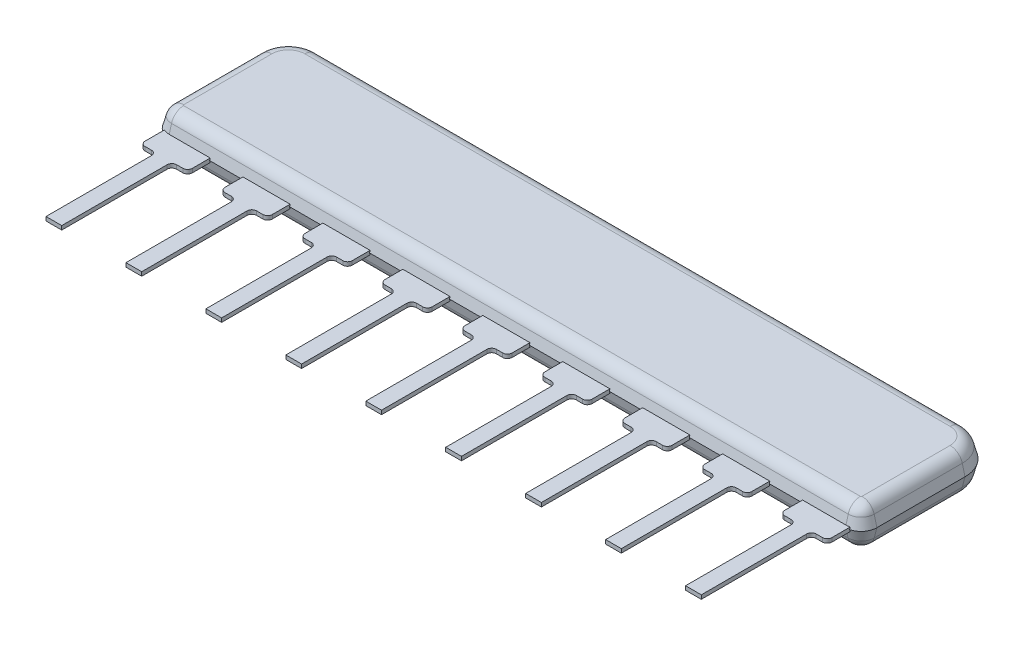
from build123d import *

# Parameters (mm, degrees)
EXTRUDE1_DEPTH           = 0.625
EXTRUDE1_TAPER           = 15.000000000000034
EXTRUDE1_OTHER_WAY_DEPTH = 0.625
EXTRUDE1_OTHER_WAY_TAPER = 15.000000000000034
EXTRUDE2_DEPTH           = 0.0625
FILLET1_R                = 0.4


with BuildPart() as part:
    # Sketch1 → Extrude1 (new body)
    with BuildSketch(Plane(origin=(0, 0, 0), x_dir=(1, 0, 0), z_dir=(0, 1, 0))):
        with BuildLine():
            Line((0.5000000000000039, 0), (21.999999999999996, 0))
            ThreePointArc((21.999999999999996, 0), (22.35355339059327, 0.14644660940672627), (22.499999999999996, 0.5000000000000001))
            Line((22.499999999999996, 0.5000000000000001), (22.499999999999996, 3.3))
            ThreePointArc((22.499999999999996, 3.3), (22.207106781186543, 4.0071067811865495), (21.499999999999993, 4.3))
            Line((21.499999999999993, 4.3), (1, 4.3))
            ThreePointArc((1, 4.3), (0.29289321881345254, 4.007106781186548), (0, 3.3))
            Line((0, 3.3), (3.4e-16, 0.5000000000000039))
            ThreePointArc((3.4e-16, 0.5000000000000039), (0.1464466094067266, 0.1464466094067262), (0.5000000000000039, 0))
        make_face()
    extrude(amount=EXTRUDE1_DEPTH, taper=EXTRUDE1_TAPER)

    # Sketch1 → Extrude1 other way (add)
    with BuildSketch(Plane(origin=(0, 0, 0), x_dir=(1, 0, 0), z_dir=(0, 1, 0))):
        with BuildLine():
            Line((0.5000000000000039, 0), (21.999999999999996, 0))
            ThreePointArc((21.999999999999996, 0), (22.35355339059327, 0.14644660940672627), (22.499999999999996, 0.5000000000000001))
            Line((22.499999999999996, 0.5000000000000001), (22.499999999999996, 3.3))
            ThreePointArc((22.499999999999996, 3.3), (22.207106781186543, 4.0071067811865495), (21.499999999999993, 4.3))
            Line((21.499999999999993, 4.3), (1, 4.3))
            ThreePointArc((1, 4.3), (0.29289321881345254, 4.007106781186548), (0, 3.3))
            Line((0, 3.3), (3.4e-16, 0.5000000000000039))
            ThreePointArc((3.4e-16, 0.5000000000000039), (0.1464466094067266, 0.1464466094067262), (0.5000000000000039, 0))
        make_face()
    extrude(amount=-EXTRUDE1_OTHER_WAY_DEPTH, taper=EXTRUDE1_OTHER_WAY_TAPER)

    # Sketch2 → Extrude2 (add, symmetric)
    with BuildSketch(Plane(origin=(0, 0, 0), x_dir=(1, 0, 0), z_dir=(0, 1, 0))):
        with BuildLine():
            Line((0.29999999999999993, 0.402178315589587), (0.30000000000000016, -0.5499999999999957))
            ThreePointArc((0.30000000000000016, -0.5499999999999957), (0.343933982822018, -0.6560660171779779), (0.4500000000000001, -0.6999999999999956))
            Line((0.4500000000000001, -0.6999999999999956), (0.6500000000000001, -0.6999999999999955))
            ThreePointArc((0.6500000000000001, -0.6999999999999955), (0.7560660171779824, -0.7439339828220134), (0.8000000000000002, -0.8499999999999956))
            Line((0.8000000000000002, -0.8499999999999956), (0.8000000000000006, -4.199999999999996))
            Line((0.8000000000000006, -4.199999999999996), (1.3000000000000005, -4.199999999999996))
            Line((1.3000000000000005, -4.199999999999996), (1.3000000000000005, -0.8499999999999995))
            ThreePointArc((1.3000000000000005, -0.8499999999999995), (1.3439339828220185, -0.7439339828220173), (1.4500000000000006, -0.6999999999999995))
            Line((1.4500000000000006, -0.6999999999999995), (1.6500000000000001, -0.6999999999999995))
            ThreePointArc((1.6500000000000001, -0.6999999999999995), (1.7560660171779823, -0.6560660171779816), (1.8, -0.5499999999999996))
            Line((1.8, -0.5499999999999996), (1.8000000000000003, 0.402178315589587))
            Line((1.8000000000000003, 0.402178315589587), (0.29999999999999993, 0.402178315589587))
        make_face()
        with BuildLine():
            Line((2.8399999999999963, 0.402178315589587), (2.8399999999999963, -0.5499999999999957))
            ThreePointArc((2.8399999999999963, -0.5499999999999957), (2.8839339828220143, -0.6560660171779777), (2.989999999999996, -0.6999999999999956))
            Line((2.989999999999996, -0.6999999999999956), (3.189999999999997, -0.6999999999999955))
            ThreePointArc((3.189999999999997, -0.6999999999999955), (3.296066017177979, -0.7439339828220134), (3.3399999999999967, -0.8499999999999956))
            Line((3.3399999999999967, -0.8499999999999956), (3.3399999999999967, -4.199999999999996))
            Line((3.3399999999999967, -4.199999999999996), (3.839999999999997, -4.199999999999996))
            Line((3.839999999999997, -4.199999999999996), (3.839999999999997, -0.8499999999999995))
            ThreePointArc((3.839999999999997, -0.8499999999999995), (3.883933982822015, -0.7439339828220175), (3.989999999999997, -0.6999999999999995))
            Line((3.989999999999997, -0.6999999999999995), (4.189999999999997, -0.6999999999999995))
            ThreePointArc((4.189999999999997, -0.6999999999999995), (4.296066017177979, -0.6560660171779813), (4.339999999999996, -0.5499999999999996))
            Line((4.339999999999996, -0.5499999999999996), (4.339999999999996, 0.402178315589587))
            Line((4.339999999999996, 0.402178315589587), (2.8399999999999963, 0.402178315589587))
        make_face()
        with BuildLine():
            Line((5.379999999999993, 0.402178315589587), (5.379999999999993, -0.5499999999999957))
            ThreePointArc((5.379999999999993, -0.5499999999999957), (5.42393398282201, -0.6560660171779774), (5.529999999999992, -0.6999999999999956))
            Line((5.529999999999992, -0.6999999999999956), (5.729999999999993, -0.6999999999999955))
            ThreePointArc((5.729999999999993, -0.6999999999999955), (5.836066017177975, -0.7439339828220134), (5.879999999999993, -0.8499999999999956))
            Line((5.879999999999993, -0.8499999999999956), (5.879999999999993, -4.199999999999996))
            Line((5.879999999999993, -4.199999999999996), (6.379999999999994, -4.199999999999996))
            Line((6.379999999999994, -4.199999999999996), (6.379999999999994, -0.8499999999999995))
            ThreePointArc((6.379999999999994, -0.8499999999999995), (6.423933982822011, -0.7439339828220177), (6.529999999999993, -0.6999999999999995))
            Line((6.529999999999993, -0.6999999999999995), (6.729999999999993, -0.6999999999999995))
            ThreePointArc((6.729999999999993, -0.6999999999999995), (6.836066017177975, -0.6560660171779813), (6.879999999999993, -0.5499999999999996))
            Line((6.879999999999993, -0.5499999999999996), (6.879999999999993, 0.402178315589587))
            Line((6.879999999999993, 0.402178315589587), (5.379999999999993, 0.402178315589587))
        make_face()
        with BuildLine():
            Line((7.919999999999989, 0.402178315589587), (7.919999999999989, -0.5499999999999957))
            ThreePointArc((7.919999999999989, -0.5499999999999957), (7.963933982822007, -0.6560660171779769), (8.069999999999988, -0.6999999999999956))
            Line((8.069999999999988, -0.6999999999999956), (8.269999999999989, -0.6999999999999955))
            ThreePointArc((8.269999999999989, -0.6999999999999955), (8.37606601717797, -0.7439339828220134), (8.41999999999999, -0.8499999999999956))
            Line((8.41999999999999, -0.8499999999999956), (8.41999999999999, -4.199999999999996))
            Line((8.41999999999999, -4.199999999999996), (8.919999999999991, -4.199999999999996))
            Line((8.919999999999991, -4.199999999999996), (8.919999999999991, -0.8499999999999995))
            ThreePointArc((8.919999999999991, -0.8499999999999995), (8.963933982822008, -0.7439339828220184), (9.06999999999999, -0.6999999999999995))
            Line((9.06999999999999, -0.6999999999999995), (9.26999999999999, -0.6999999999999995))
            ThreePointArc((9.26999999999999, -0.6999999999999995), (9.376066017177973, -0.6560660171779807), (9.41999999999999, -0.5499999999999996))
            Line((9.41999999999999, -0.5499999999999996), (9.41999999999999, 0.402178315589587))
            Line((9.41999999999999, 0.402178315589587), (7.919999999999989, 0.402178315589587))
        make_face()
        with BuildLine():
            Line((10.459999999999987, 0.402178315589587), (10.459999999999987, -0.5499999999999957))
            ThreePointArc((10.459999999999987, -0.5499999999999957), (10.503933982822003, -0.6560660171779755), (10.609999999999983, -0.6999999999999956))
            Line((10.609999999999983, -0.6999999999999956), (10.809999999999986, -0.6999999999999955))
            ThreePointArc((10.809999999999986, -0.6999999999999955), (10.916066017177968, -0.7439339828220134), (10.959999999999987, -0.8499999999999956))
            Line((10.959999999999987, -0.8499999999999956), (10.959999999999987, -4.199999999999996))
            Line((10.959999999999987, -4.199999999999996), (11.459999999999988, -4.199999999999996))
            Line((11.459999999999988, -4.199999999999996), (11.459999999999988, -0.8499999999999995))
            ThreePointArc((11.459999999999988, -0.8499999999999995), (11.503933982822005, -0.7439339828220196), (11.609999999999985, -0.6999999999999995))
            Line((11.609999999999985, -0.6999999999999995), (11.809999999999988, -0.6999999999999995))
            ThreePointArc((11.809999999999988, -0.6999999999999995), (11.916066017177968, -0.6560660171779794), (11.959999999999985, -0.5499999999999996))
            Line((11.959999999999985, -0.5499999999999996), (11.959999999999985, 0.402178315589587))
            Line((11.959999999999985, 0.402178315589587), (10.459999999999987, 0.402178315589587))
        make_face()
        with BuildLine():
            Line((12.999999999999984, 0.402178315589587), (12.999999999999984, -0.5499999999999957))
            ThreePointArc((12.999999999999984, -0.5499999999999957), (13.043933982822, -0.6560660171779755), (13.14999999999998, -0.6999999999999956))
            Line((13.14999999999998, -0.6999999999999956), (13.349999999999984, -0.6999999999999955))
            ThreePointArc((13.349999999999984, -0.6999999999999955), (13.456066017177966, -0.7439339828220134), (13.499999999999984, -0.8499999999999956))
            Line((13.499999999999984, -0.8499999999999956), (13.499999999999984, -4.199999999999996))
            Line((13.499999999999984, -4.199999999999996), (13.999999999999984, -4.199999999999996))
            Line((13.999999999999984, -4.199999999999996), (13.999999999999984, -0.8499999999999995))
            ThreePointArc((13.999999999999984, -0.8499999999999995), (14.043933982822, -0.7439339828220184), (14.149999999999983, -0.6999999999999995))
            Line((14.149999999999983, -0.6999999999999995), (14.349999999999984, -0.6999999999999995))
            ThreePointArc((14.349999999999984, -0.6999999999999995), (14.456066017177966, -0.6560660171779807), (14.499999999999982, -0.5499999999999996))
            Line((14.499999999999982, -0.5499999999999996), (14.499999999999982, 0.402178315589587))
            Line((14.499999999999982, 0.402178315589587), (12.999999999999984, 0.402178315589587))
        make_face()
        with BuildLine():
            Line((15.539999999999981, 0.402178315589587), (15.539999999999981, -0.5499999999999957))
            ThreePointArc((15.539999999999981, -0.5499999999999957), (15.583933982821998, -0.6560660171779755), (15.689999999999978, -0.6999999999999956))
            Line((15.689999999999978, -0.6999999999999956), (15.889999999999981, -0.6999999999999955))
            ThreePointArc((15.889999999999981, -0.6999999999999955), (15.996066017177963, -0.7439339828220134), (16.03999999999998, -0.8499999999999956))
            Line((16.03999999999998, -0.8499999999999956), (16.03999999999998, -4.199999999999996))
            Line((16.03999999999998, -4.199999999999996), (16.53999999999998, -4.199999999999996))
            Line((16.53999999999998, -4.199999999999996), (16.53999999999998, -0.8499999999999995))
            ThreePointArc((16.53999999999998, -0.8499999999999995), (16.583933982822, -0.7439339828220184), (16.68999999999998, -0.6999999999999995))
            Line((16.68999999999998, -0.6999999999999995), (16.889999999999983, -0.6999999999999995))
            ThreePointArc((16.889999999999983, -0.6999999999999995), (16.996066017177963, -0.6560660171779782), (17.039999999999978, -0.5499999999999996))
            Line((17.039999999999978, -0.5499999999999996), (17.039999999999978, 0.402178315589587))
            Line((17.039999999999978, 0.402178315589587), (15.539999999999981, 0.402178315589587))
        make_face()
        with BuildLine():
            Line((18.079999999999977, 0.402178315589587), (18.079999999999977, -0.5499999999999957))
            ThreePointArc((18.079999999999977, -0.5499999999999957), (18.123933982821995, -0.6560660171779769), (18.229999999999976, -0.6999999999999956))
            Line((18.229999999999976, -0.6999999999999956), (18.42999999999998, -0.6999999999999955))
            ThreePointArc((18.42999999999998, -0.6999999999999955), (18.536066017177962, -0.7439339828220134), (18.579999999999977, -0.8499999999999956))
            Line((18.579999999999977, -0.8499999999999956), (18.579999999999977, -4.199999999999996))
            Line((18.579999999999977, -4.199999999999996), (19.07999999999998, -4.199999999999996))
            Line((19.07999999999998, -4.199999999999996), (19.07999999999998, -0.8499999999999995))
            ThreePointArc((19.07999999999998, -0.8499999999999995), (19.123933982821995, -0.743933982822021), (19.229999999999976, -0.6999999999999995))
            Line((19.229999999999976, -0.6999999999999995), (19.42999999999998, -0.6999999999999995))
            ThreePointArc((19.42999999999998, -0.6999999999999995), (19.53606601717796, -0.6560660171779807), (19.579999999999977, -0.5499999999999996))
            Line((19.579999999999977, -0.5499999999999996), (19.579999999999977, 0.402178315589587))
            Line((19.579999999999977, 0.402178315589587), (18.079999999999977, 0.402178315589587))
        make_face()
        with BuildLine():
            Line((20.619999999999973, 0.402178315589587), (20.619999999999973, -0.5499999999999957))
            ThreePointArc((20.619999999999973, -0.5499999999999957), (20.663933982821987, -0.6560660171779743), (20.769999999999968, -0.6999999999999956))
            Line((20.769999999999968, -0.6999999999999956), (20.96999999999997, -0.6999999999999955))
            ThreePointArc((20.96999999999997, -0.6999999999999955), (21.076066017177954, -0.7439339828220134), (21.11999999999997, -0.8499999999999956))
            Line((21.11999999999997, -0.8499999999999956), (21.119999999999973, -4.199999999999996))
            Line((21.119999999999973, -4.199999999999996), (21.61999999999997, -4.199999999999996))
            Line((21.61999999999997, -4.199999999999996), (21.61999999999997, -0.8499999999999995))
            ThreePointArc((21.61999999999997, -0.8499999999999995), (21.663933982821987, -0.743933982822016), (21.76999999999997, -0.6999999999999995))
            Line((21.76999999999997, -0.6999999999999995), (21.96999999999997, -0.6999999999999995))
            ThreePointArc((21.96999999999997, -0.6999999999999995), (22.07606601717795, -0.6560660171779807), (22.11999999999997, -0.5499999999999996))
            Line((22.11999999999997, -0.5499999999999996), (22.11999999999997, 0.402178315589587))
            Line((22.11999999999997, 0.402178315589587), (20.619999999999973, 0.402178315589587))
        make_face()
    extrude(amount=EXTRUDE2_DEPTH, both=True)

    # Fillet1
    fillet1_edges = [part.edges().sort_by_distance(p)[0] for p in [
        (0.26486454127016756, -0.625, -0.2648645412701678),
        (11.249999999999996, -0.625, -0.16746824526945203),
        (22.23513545872983, -0.625, -0.2648645412701671),
        (22.332531754730546, -0.625, -1.9000000000000015),
        (22.088688849323106, -0.625, -3.888688849323105),
        (11.25, -0.625, -4.132531754730548),
        (0.4113111506768945, 0.625, -3.888688849323106),
        (0.16746824526945225, 0.625, -1.9),
        (0.26486454127016756, 0.625, -0.2648645412701678),
        (11.249999999999996, 0.625, -0.16746824526945203),
        (22.23513545872983, 0.625, -0.2648645412701671),
        (22.332531754730546, 0.625, -1.9000000000000015),
        (22.088688849323106, 0.625, -3.888688849323105),
        (11.25, 0.625, -4.132531754730548),
        (0.4113111506768945, -0.625, -3.888688849323106),
        (0.16746824526945225, -0.625, -1.9),
    ]]
    fillet(fillet1_edges, radius=FILLET1_R)


solid = part.part
